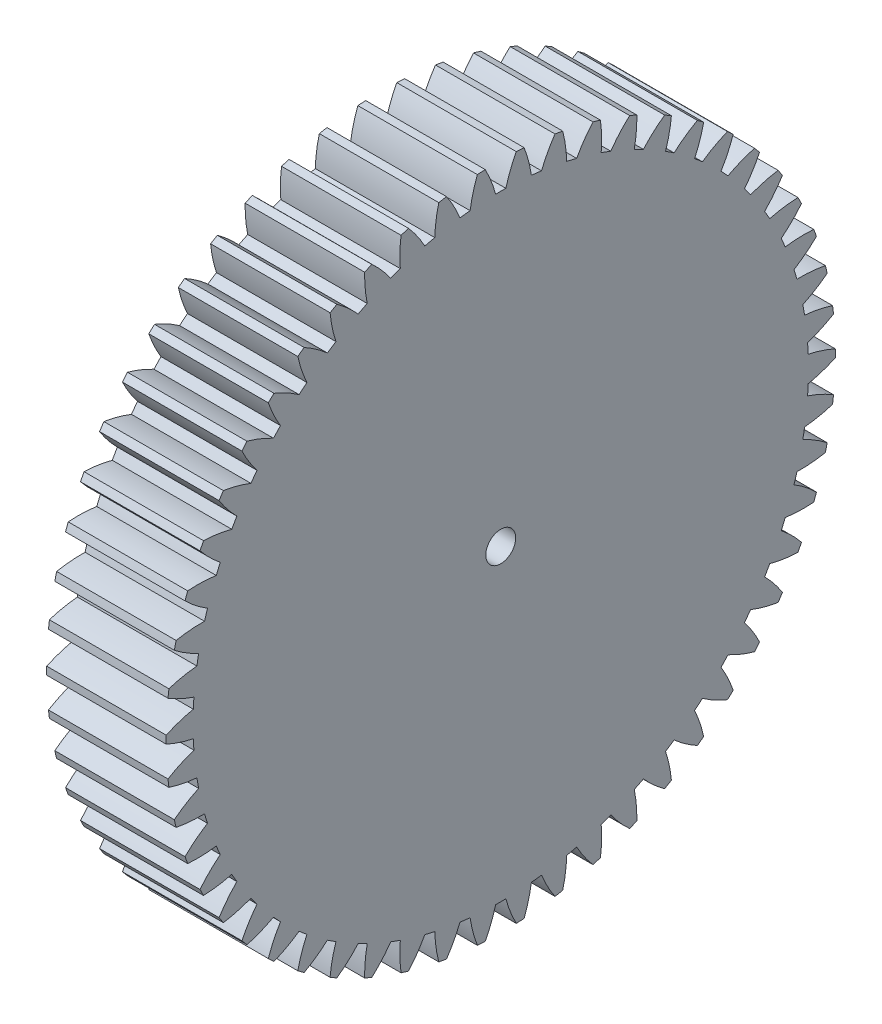
from build123d import *

# Parameters (mm, degrees)
BASPROSKE_W     = 20
BASPROSKE_H     = 56
TOOTHCUT_DEPTH  = 82.682311427
TEETHCUTS_COUNT = 54
TEETHCUTS_ANGLE = 353.333333333
BORSKE_R        = 2.5
BORE_DEPTH      = 50.0000508


with BuildPart() as part:
    # BasProSke → Base-Revolve (revolve)
    with BuildSketch(Plane(origin=(0, 0, 0), x_dir=(1, 0, 0), z_dir=(0, 1, 0)), mode=Mode.PRIVATE) as base_revolve_sk:
        with Locations((10, 28)):
            Rectangle(BASPROSKE_W, BASPROSKE_H)
    revolve(base_revolve_sk.sketch.rotate(Axis((-10, 0, 0), (1, 0, 0)), 180), axis=Axis((-10, 0, 0), (1, 0, 0)))

    # TooCutSke → ToothCut (cut, through all)
    with BuildSketch(Plane(origin=(0, 0, 0), x_dir=(0, 0, -1), z_dir=(1, 0, 0))):
        with BuildLine():
            ThreePointArc((0.853930211, 51.491919795), (0, 51.499), (-0.853930211, 51.491919795))
            ThreePointArc((-0.853930211, 51.491919795), (-1.60941272, 53.777264131), (-2.614474643, 55.964363371))
            ThreePointArc((-2.614474643, 55.964363371), (0, 56.0254), (2.614474643, 55.964363371))
            ThreePointArc((2.614474643, 55.964363371), (1.60941272, 53.777264131), (0.853930211, 51.491919795))
        make_face()
    toothcut = extrude(amount=TOOTHCUT_DEPTH, mode=Mode.SUBTRACT)

    # TeethCuts: ToothCut ×54 about axis
    teethcuts_axis = Axis((-10, 0, 0), (1, 0, 0))
    for i in range(1, TEETHCUTS_COUNT):
        add(toothcut.rotate(teethcuts_axis, i * TEETHCUTS_ANGLE / (TEETHCUTS_COUNT - 1)), mode=Mode.SUBTRACT)

    # BorSke → Bore (cut, symmetric)
    with BuildSketch(Plane(origin=(0, 0, 0), x_dir=(0, 0, -1), z_dir=(1, 0, 0))):
        with Locations(Location((0, 0, 0), (0, 0, 180))):
            Circle(BORSKE_R)
    extrude(amount=BORE_DEPTH, both=True, mode=Mode.SUBTRACT)


solid = part.part
